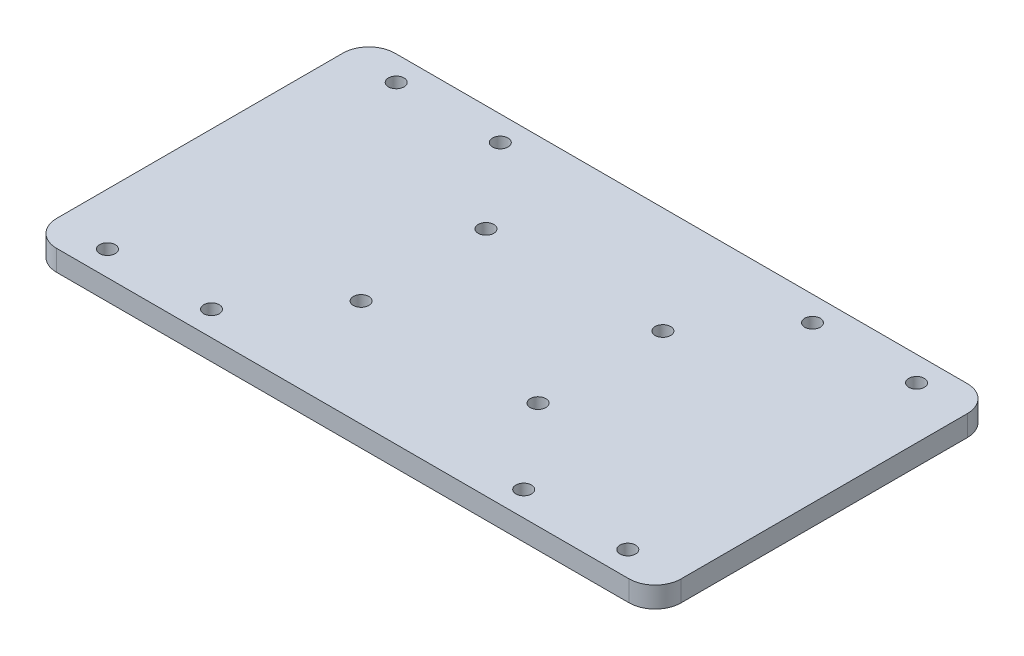
from build123d import *

# Parameters (mm, degrees)
SKETCH_1_W          = 120
SKETCH_1_H          = 65
EXTRUDE_1_DEPTH     = 4
SKETCH_2_R          = 1.5
CUT_EXTRUDE_1_DEPTH = 4
FILLET_1_R          = 5
SKETCH_3_R          = 1.5
CUT_EXTRUDE_2_DEPTH = 69.353858706


with BuildPart() as part:
    # 草图1 → 凸台-拉伸1 (new body)
    with BuildSketch(Plane(origin=(0, 0, 0), x_dir=(1, 0, 0), z_dir=(0, 1, 0))):
        Rectangle(SKETCH_1_W, SKETCH_1_H)
    extrude(amount=EXTRUDE_1_DEPTH)

    # 草图2 → 切除-拉伸1 (cut)
    with BuildSketch(Plane(origin=(0, 4, 0), x_dir=(1, 0, 0), z_dir=(0, 1, 0))):
        with Locations(Location((50, -27.75, 0), (0, 0, 270))):
            Circle(SKETCH_2_R)
        with Locations(Location((50, 27.75, 0), (0, 0, 270))):
            Circle(SKETCH_2_R)
        with Locations(Location((30, 27.75, 0), (0, 0, 270))):
            Circle(SKETCH_2_R)
        with Locations(Location((30, -27.75, 0), (0, 0, 270))):
            Circle(SKETCH_2_R)
    cut_extrude_1 = extrude(amount=-CUT_EXTRUDE_1_DEPTH, mode=Mode.SUBTRACT)

    # 镜向2: 切除-拉伸1 across plane
    add(cut_extrude_1.mirror(Plane(origin=(0, 0, 0), x_dir=(0, 0, 1), z_dir=(1, 0, 0))), mode=Mode.SUBTRACT)

    # 圆角1
    fillet_1_edges = [part.edges().sort_by_distance(p)[0] for p in [
        (60, 2, 32.5),
        (-60, 2, 32.5),
        (-60, 2, -32.5),
        (60, 2, -32.5),
    ]]
    fillet(fillet_1_edges, radius=FILLET_1_R)

    # 草图3 → 切除-拉伸2 (cut, through all)
    with BuildSketch(Plane.XZ):
        with Locations(Location((-17, 12, 0), (0, 0, 270))):
            Circle(SKETCH_3_R)
        with Locations(Location((17, 12, 0), (0, 0, 270))):
            Circle(SKETCH_3_R)
        with Locations(Location((17, -12, 0), (0, 0, 270))):
            Circle(SKETCH_3_R)
        with Locations(Location((-17, -12, 0), (0, 0, 270))):
            Circle(SKETCH_3_R)
    extrude(amount=-CUT_EXTRUDE_2_DEPTH, mode=Mode.SUBTRACT)


solid = part.part
